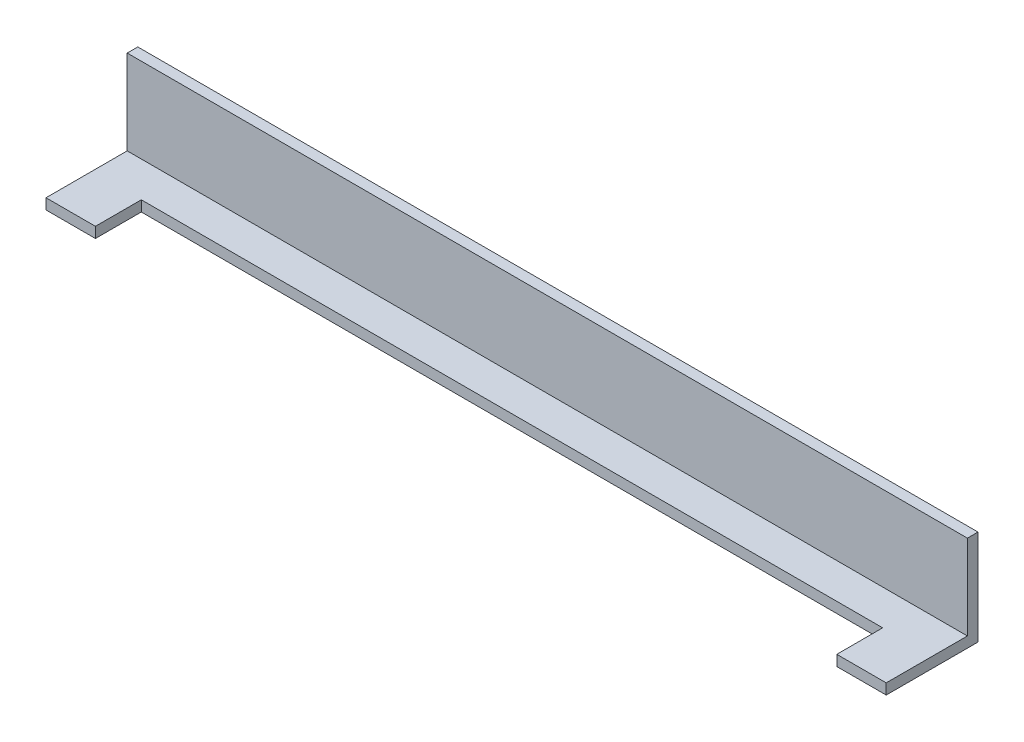
from build123d import *

# Parameters (mm, degrees)
SKETCH1_W           = 238
SKETCH1_H           = 13
BOSS_EXTRUDE1_DEPTH = 3
SKETCH2_W           = 238
SKETCH2_H           = 3
BOSS_EXTRUDE2_DEPTH = 24
SKETCH3_W           = 14
SKETCH3_H           = 26
BOSS_EXTRUDE3_DEPTH = 3
SKETCH5_W           = 14
SKETCH5_H           = 23
BOSS_EXTRUDE5_DEPTH = 3


with BuildPart() as part:
    # Sketch1 → Boss-Extrude1 (new body)
    with BuildSketch(Plane(origin=(0, 0, 0), x_dir=(1, 0, 0), z_dir=(0, 1, 0))):
        with Locations((-119, -6.5)):
            Rectangle(SKETCH1_W, SKETCH1_H)
    extrude(amount=BOSS_EXTRUDE1_DEPTH)

    # Sketch2 → Boss-Extrude2 (add)
    with BuildSketch(Plane(origin=(0, 3, 0), x_dir=(1, 0, 0), z_dir=(0, 1, 0))):
        with Locations((-119, -1.5)):
            Rectangle(SKETCH2_W, SKETCH2_H)
    extrude(amount=BOSS_EXTRUDE2_DEPTH)

    # Sketch3 → Boss-Extrude3 (add)
    with BuildSketch(Plane.XZ):
        with Locations((-7, 13)):
            Rectangle(SKETCH3_W, SKETCH3_H)
    extrude(amount=-BOSS_EXTRUDE3_DEPTH)

    # Sketch5 → Boss-Extrude5 (add)
    with BuildSketch(Plane(origin=(0, 3, 0), x_dir=(1, 0, 0), z_dir=(0, 1, 0))):
        with Locations((-231, -14.5)):
            Rectangle(SKETCH5_W, SKETCH5_H)
    extrude(amount=-BOSS_EXTRUDE5_DEPTH)


solid = part.part
